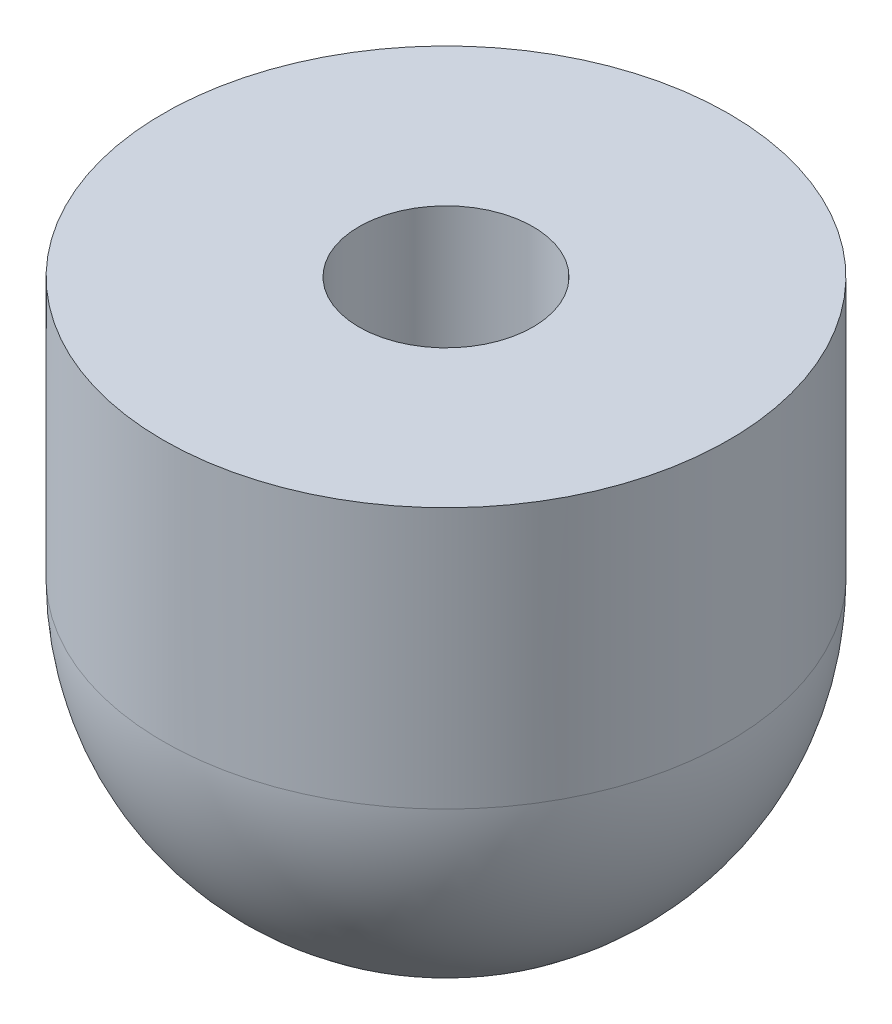
from build123d import *

# Parameters (mm, degrees)
SKETCH1_R           = 13
BOSS_EXTRUDE1_DEPTH = 25
SKETCH2_R           = 4
CUT_EXTRUDE1_DEPTH  = 8
SKETCH4_W           = 4.368412871
SKETCH4_H           = 18.958156908


with BuildPart() as part:
    # Sketch1 → Boss-Extrude1 (new body)
    with BuildSketch(Plane(origin=(0, 0, 0), x_dir=(1, 0, 0), z_dir=(0, 1, 0))):
        with Locations(Location((0, 0, 0), (0, 0, 270))):
            Circle(SKETCH1_R)
    extrude(amount=BOSS_EXTRUDE1_DEPTH)

    # Sketch2 → Cut-Extrude1 (cut)
    with BuildSketch(Plane(origin=(0, 25, 0), x_dir=(1, 0, 0), z_dir=(0, 1, 0))):
        with Locations(Location((0, 0, 0), (0, 0, 270))):
            Circle(SKETCH2_R)
    extrude(amount=-CUT_EXTRUDE1_DEPTH, mode=Mode.SUBTRACT)

    # Sketch4 → Cut-Revolve1 (revolve, cut)
    with BuildSketch(Plane.XY, mode=Mode.PRIVATE) as cut_revolve1_sk:
        with BuildLine():
            ThreePointArc((0, 0), (-9.192388155, 3.807611845), (-13, 13))
            Line((-13, 13), (-13, -5.958156908))
            Line((-13, -5.958156908), (0, -5.958156908))
            Line((0, -5.958156908), (0, 0))
        make_face()
        with Locations((-15.184206436, 3.520921546)):
            Rectangle(SKETCH4_W, SKETCH4_H)
    revolve(cut_revolve1_sk.sketch.rotate(Axis((0, -5.958156908, 0), (0, 1, 0)), 270), axis=Axis((0, -5.958156908, 0), (0, 1, 0)), mode=Mode.SUBTRACT)


solid = part.part
